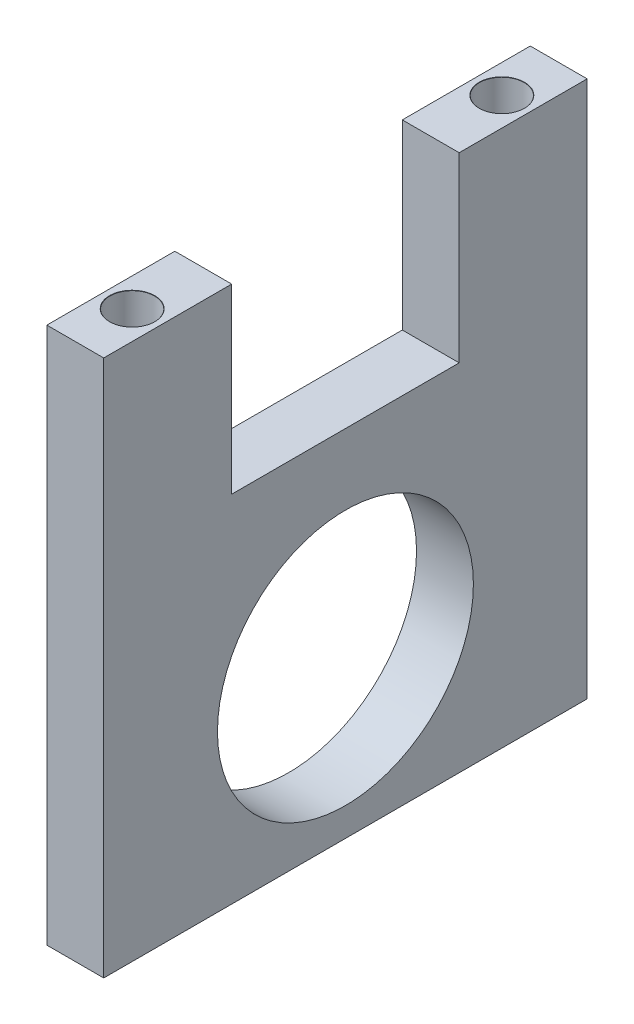
from build123d import *

# Parameters (mm, degrees)
BOSS_EXTRUDE1_START             = 170.258318
SKETCH6_R                       = 14.2875
BOSS_EXTRUDE1_DEPTH             = 6.35
F_5_0MM_DOWEL_HOLE1_D           = 5
F_5_0MM_DOWEL_HOLE1_DEPTH       = 25.4
F_5_0MM_DOWEL_HOLE1_CSINK_D     = 5.05
F_5_0MM_DOWEL_HOLE1_CSINK_ANGLE = 90
F_5_0MM_DOWEL_HOLE1_TIP         = 1.502151548


with BuildPart() as part:
    # Sketch6 → Boss-Extrude1 (new body)
    with BuildSketch(Plane(origin=(0, 0, 0), x_dir=(0, 0, -1), z_dir=(1, 0, 0)).offset(BOSS_EXTRUDE1_START)):
        Polygon((74.6125, 36.5633), (128.5875, 36.5633), (128.5875, 96.52), (114.3, 96.52), (114.3, 76.2), (88.9, 76.2), (88.9, 96.52), (74.6125, 96.52), align=None)
        with Locations((101.6, 54.0258)):
            Circle(SKETCH6_R, mode=Mode.SUBTRACT)
    extrude(amount=-BOSS_EXTRUDE1_DEPTH)

    # Ø5.0mm Dowel Hole1
    with Locations(Plane(origin=(0, 96.52, 0), x_dir=(1, 0, 0), z_dir=(0, 1, 0))):
        with Locations((167.083317581, 122.2375), (167.083317581, 80.9625)):
            CounterSinkHole(F_5_0MM_DOWEL_HOLE1_D / 2, F_5_0MM_DOWEL_HOLE1_CSINK_D / 2, depth=F_5_0MM_DOWEL_HOLE1_DEPTH, counter_sink_angle=F_5_0MM_DOWEL_HOLE1_CSINK_ANGLE)
            with Locations((0, 0, -(F_5_0MM_DOWEL_HOLE1_DEPTH + F_5_0MM_DOWEL_HOLE1_TIP / 2))):  # 118° drill point
                Cone(0, F_5_0MM_DOWEL_HOLE1_D / 2, F_5_0MM_DOWEL_HOLE1_TIP, mode=Mode.SUBTRACT)


solid = part.part
